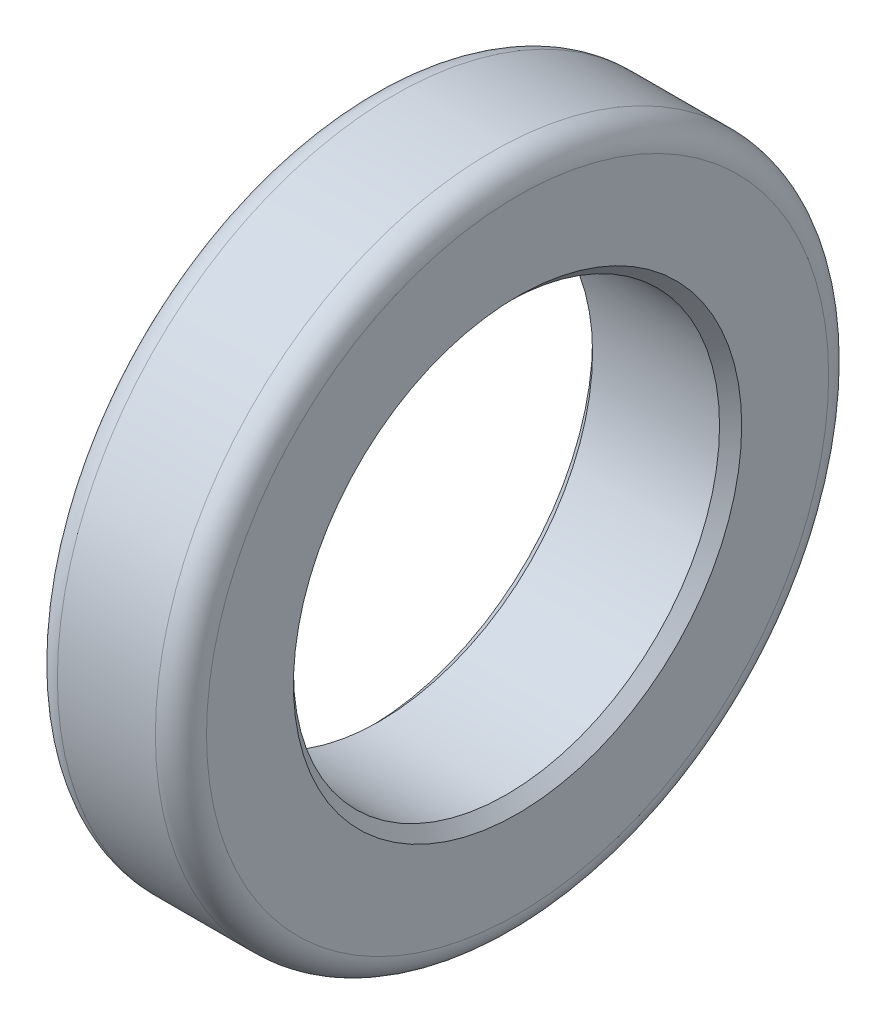
from build123d import *

# Parameters (mm, degrees)
SKETCH1_R           = 39.5
SKETCH1_R_2         = 25
BOSS_EXTRUDE1_DEPTH = 8.75
FILLET1_R           = 3
CHAMFER1_SIZE       = 1.3


with BuildPart() as part:
    # Sketch1 → Boss-Extrude1 (new, symmetric)
    with BuildSketch(Plane(origin=(0, 0, 0), x_dir=(0, 0, -1), z_dir=(1, 0, 0))):
        Circle(SKETCH1_R)
        Circle(SKETCH1_R_2, mode=Mode.SUBTRACT)
    extrude(amount=BOSS_EXTRUDE1_DEPTH, both=True)

    # Fillet1
    fillet1_edges = [part.edges().sort_by_distance(p)[0] for p in [
        (-8.75, 0, 39.5),
        (8.75, 0, 39.5),
    ]]
    fillet(fillet1_edges, radius=FILLET1_R)

    # Chamfer1
    chamfer1_edges = [part.edges().sort_by_distance(p)[0] for p in [
        (-8.75, 0, 25),
        (8.75, 0, 25),
    ]]
    chamfer(chamfer1_edges, length=CHAMFER1_SIZE)


solid = part.part
